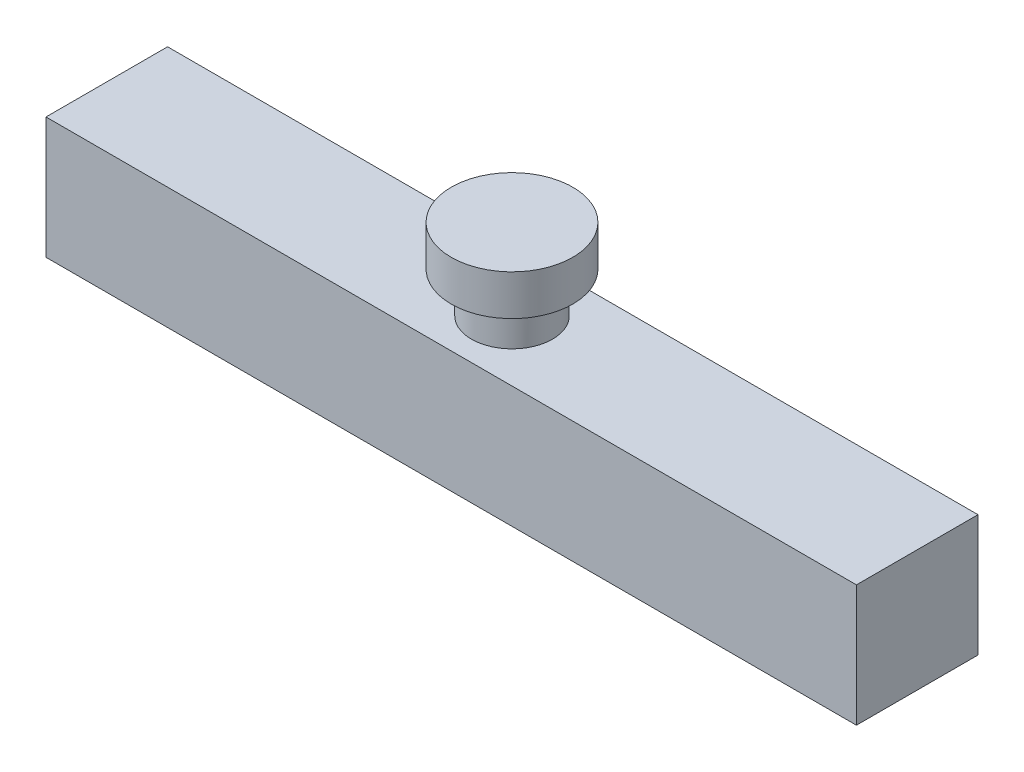
from build123d import *

# Parameters (mm, degrees)
SKETCH1_W           = 200
SKETCH1_H           = 60
BOSS_EXTRUDE1_DEPTH = 30
SKETCH2_R           = 10
BOSS_EXTRUDE3_DEPTH = 10
SKETCH3_R           = 15
BOSS_EXTRUDE4_DEPTH = 10
SKETCH4_W           = 200
SKETCH4_H           = 15
CUT_EXTRUDE1_DEPTH  = 50


with BuildPart() as part:
    # Sketch1 → Boss-Extrude1 (new body)
    with BuildSketch(Plane(origin=(0, 0, 0), x_dir=(1, 0, 0), z_dir=(0, 1, 0))):
        with Locations((100, -30)):
            Rectangle(SKETCH1_W, SKETCH1_H)
    extrude(amount=-BOSS_EXTRUDE1_DEPTH)

    # Sketch2 → Boss-Extrude3 (add)
    with BuildSketch(Plane(origin=(0, 0, 0), x_dir=(1, 0, 0), z_dir=(0, 1, 0))):
        with Locations(Location((100, -30, 0), (0, 0, 90))):
            Circle(SKETCH2_R)
    extrude(amount=BOSS_EXTRUDE3_DEPTH)

    # Sketch3 → Boss-Extrude4 (add)
    with BuildSketch(Plane(origin=(0, 10, 0), x_dir=(1, 0, 0), z_dir=(0, 1, 0))):
        with Locations(Location((100, -30, 0), (0, 0, 270))):
            Circle(SKETCH3_R)
    extrude(amount=BOSS_EXTRUDE4_DEPTH)

    # Sketch4 → Cut-Extrude1 (cut)
    with BuildSketch(Plane(origin=(0, 0, 0), x_dir=(1, 0, 0), z_dir=(0, 1, 0))):
        with Locations((100, -7.5)):
            Rectangle(SKETCH4_W, SKETCH4_H)
        with Locations((100, -52.5)):
            Rectangle(SKETCH4_W, SKETCH4_H)
    extrude(amount=-CUT_EXTRUDE1_DEPTH, mode=Mode.SUBTRACT)


solid = part.part
